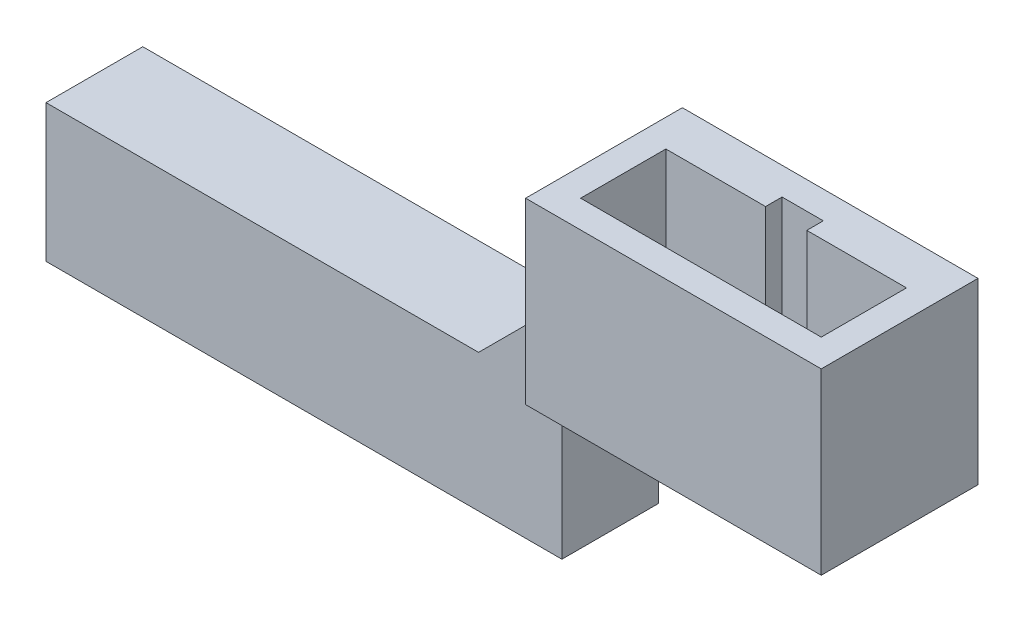
from build123d import *

# Parameters (mm, degrees)
SKETCH1_W           = 37.52
SKETCH1_H           = 7.04
SKETCH1_W_2         = 1.5
SKETCH1_H_2         = 1.5
BOSS_EXTRUDE1_DEPTH = 8
SKETCH2_W           = 37.52
SKETCH2_H           = 7.04
BOSS_EXTRUDE2_DEPTH = 2
SKETCH3_W           = 1.06
SKETCH3_H           = 7.04
BOSS_EXTRUDE3_DEPTH = 13
CHAMFER1_SIZE       = 5


with BuildPart() as part:
    # Sketch1 → Boss-Extrude1 (new body)
    with BuildSketch(Plane(origin=(0, 0, 0), x_dir=(1, 0, 0), z_dir=(0, 1, 0))):
        with Locations((18.76, 3.52)):
            Rectangle(SKETCH1_W, SKETCH1_H)
        with Locations((4.79, 2.25)):
            Rectangle(SKETCH1_W_2, SKETCH1_H_2, mode=Mode.SUBTRACT)
        with Locations((2.25, 2.25)):
            Rectangle(SKETCH1_W_2, SKETCH1_H_2, mode=Mode.SUBTRACT)
        with Locations((7.33, 2.25)):
            Rectangle(SKETCH1_W_2, SKETCH1_H_2, mode=Mode.SUBTRACT)
        with Locations((9.87, 2.25)):
            Rectangle(SKETCH1_W_2, SKETCH1_H_2, mode=Mode.SUBTRACT)
        with Locations((12.41, 2.25)):
            Rectangle(SKETCH1_W_2, SKETCH1_H_2, mode=Mode.SUBTRACT)
        with Locations((14.95, 2.25)):
            Rectangle(SKETCH1_W_2, SKETCH1_H_2, mode=Mode.SUBTRACT)
        with Locations((17.49, 2.25)):
            Rectangle(SKETCH1_W_2, SKETCH1_H_2, mode=Mode.SUBTRACT)
        with Locations((20.03, 2.25)):
            Rectangle(SKETCH1_W_2, SKETCH1_H_2, mode=Mode.SUBTRACT)
        with Locations((22.57, 2.25)):
            Rectangle(SKETCH1_W_2, SKETCH1_H_2, mode=Mode.SUBTRACT)
        with Locations((25.11, 2.25)):
            Rectangle(SKETCH1_W_2, SKETCH1_H_2, mode=Mode.SUBTRACT)
        with Locations((27.65, 2.25)):
            Rectangle(SKETCH1_W_2, SKETCH1_H_2, mode=Mode.SUBTRACT)
        with Locations((30.19, 2.25)):
            Rectangle(SKETCH1_W_2, SKETCH1_H_2, mode=Mode.SUBTRACT)
        with Locations((32.73, 2.25)):
            Rectangle(SKETCH1_W_2, SKETCH1_H_2, mode=Mode.SUBTRACT)
        with Locations((35.27, 2.25)):
            Rectangle(SKETCH1_W_2, SKETCH1_H_2, mode=Mode.SUBTRACT)
        with Locations((4.79, 4.79)):
            Rectangle(SKETCH1_W_2, SKETCH1_H_2, mode=Mode.SUBTRACT)
        with Locations((7.33, 4.79)):
            Rectangle(SKETCH1_W_2, SKETCH1_H_2, mode=Mode.SUBTRACT)
        with Locations((9.87, 4.79)):
            Rectangle(SKETCH1_W_2, SKETCH1_H_2, mode=Mode.SUBTRACT)
        with Locations((12.41, 4.79)):
            Rectangle(SKETCH1_W_2, SKETCH1_H_2, mode=Mode.SUBTRACT)
        with Locations((14.95, 4.79)):
            Rectangle(SKETCH1_W_2, SKETCH1_H_2, mode=Mode.SUBTRACT)
        with Locations((17.49, 4.79)):
            Rectangle(SKETCH1_W_2, SKETCH1_H_2, mode=Mode.SUBTRACT)
        with Locations((20.03, 4.79)):
            Rectangle(SKETCH1_W_2, SKETCH1_H_2, mode=Mode.SUBTRACT)
        with Locations((22.57, 4.79)):
            Rectangle(SKETCH1_W_2, SKETCH1_H_2, mode=Mode.SUBTRACT)
        with Locations((25.11, 4.79)):
            Rectangle(SKETCH1_W_2, SKETCH1_H_2, mode=Mode.SUBTRACT)
        with Locations((27.65, 4.79)):
            Rectangle(SKETCH1_W_2, SKETCH1_H_2, mode=Mode.SUBTRACT)
        with Locations((30.19, 4.79)):
            Rectangle(SKETCH1_W_2, SKETCH1_H_2, mode=Mode.SUBTRACT)
        with Locations((32.73, 4.79)):
            Rectangle(SKETCH1_W_2, SKETCH1_H_2, mode=Mode.SUBTRACT)
        with Locations((35.27, 4.79)):
            Rectangle(SKETCH1_W_2, SKETCH1_H_2, mode=Mode.SUBTRACT)
        with Locations((2.25, 4.79)):
            Rectangle(SKETCH1_W_2, SKETCH1_H_2, mode=Mode.SUBTRACT)
    extrude(amount=BOSS_EXTRUDE1_DEPTH)

    # Sketch2 → Boss-Extrude2 (add)
    with BuildSketch(Plane(origin=(0, 8, 0), x_dir=(1, 0, 0), z_dir=(0, 1, 0))):
        with Locations((18.76, 3.52)):
            Rectangle(SKETCH2_W, SKETCH2_H)
    extrude(amount=BOSS_EXTRUDE2_DEPTH)

    # Sketch3 → Boss-Extrude3 (add)
    # profile 1 of 2: a face of its own
    with BuildSketch(Plane(origin=(0, 10, 0), x_dir=(1, 0, 0), z_dir=(0, 1, 0))):
        Polygon((57.96, 9.82), (36.46, 9.82), (36.46, 7.04), (37.52, 7.04), (37.52, 0), (36.46, 0), (36.46, -1.58), (57.96, -1.58), align=None)
        Polygon((38.46, 0.42), (38.46, 6.62), (45.71, 6.62), (45.71, 7.82), (48.71, 7.82), (48.71, 6.62), (55.96, 6.62), (55.96, 0.42), align=None, mode=Mode.SUBTRACT)
    # profile 2 of 2: a face of its own
    with BuildSketch(Plane(origin=(0, 10, 0), x_dir=(1, 0, 0), z_dir=(0, 1, 0))):
        with Locations((36.99, 3.52)):
            Rectangle(SKETCH3_W, SKETCH3_H)
    extrude(amount=BOSS_EXTRUDE3_DEPTH)

    # Chamfer1
    chamfer1_edges = [part.edges().sort_by_distance(p)[0] for p in [
        (36.46, 10, -3.52),
    ]]
    chamfer(chamfer1_edges, length=CHAMFER1_SIZE)


solid = part.part
